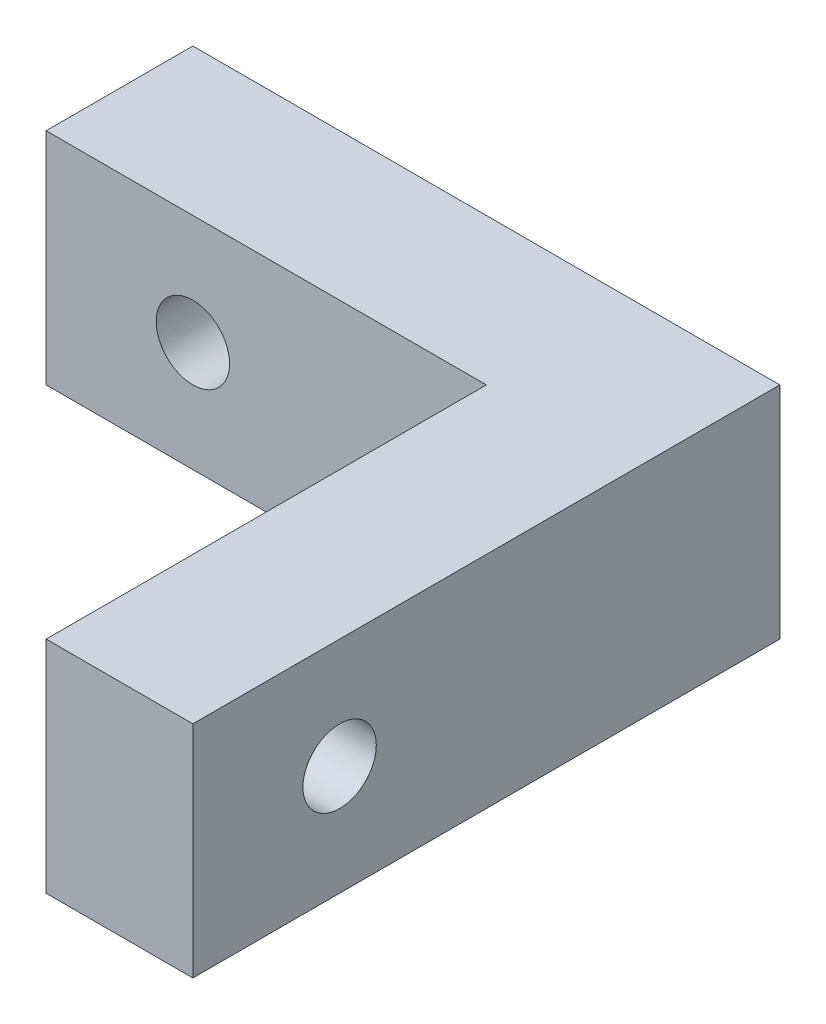
from build123d import *

# Parameters (mm, degrees)
SKETCH1_R           = 5
BOSS_EXTRUDE1_DEPTH = 20
SKETCH2_W           = 20
SKETCH2_H           = 30
BOSS_EXTRUDE2_DEPTH = 60
SKETCH3_R           = 5
CUT_EXTRUDE1_DEPTH  = 60


with BuildPart() as part:
    # Sketch1 → Boss-Extrude1 (new body)
    with BuildSketch(Plane.XY):
        Polygon((-20, 15), (-40, 15), (-40, -15), (40, -15), (40, 15), align=None)
        with Locations((-20, 0)):
            Circle(SKETCH1_R, mode=Mode.SUBTRACT)
    extrude(amount=BOSS_EXTRUDE1_DEPTH)

    # Sketch2 → Boss-Extrude2 (add)
    with BuildSketch(Plane.XY.offset(20)):
        with Locations((30, 0)):
            Rectangle(SKETCH2_W, SKETCH2_H)
    extrude(amount=BOSS_EXTRUDE2_DEPTH)

    # Sketch3 → Cut-Extrude1 (cut)
    with BuildSketch(Plane.ZY.offset(-20)):
        with Locations(Location((60, 0, 0), (0, 0, 270))):
            Circle(SKETCH3_R)
    extrude(amount=-CUT_EXTRUDE1_DEPTH, mode=Mode.SUBTRACT)


solid = part.part
